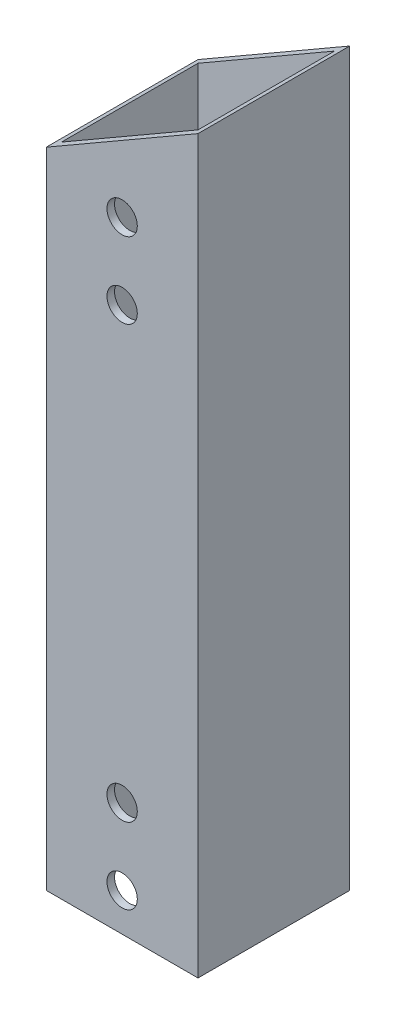
from build123d import *

# Parameters (mm, degrees)
SKETCH_1_R          = 2
EXTRUDE_1_DEPTH     = 20
SKETCH_2_W          = 18
SKETCH_2_H          = 18
CUT_EXTRUDE_1_DEPTH = 102.724540869


with BuildPart() as part:
    # 草图1 → 凸台-拉伸1 (new body)
    with BuildSketch(Plane.XY):
        Polygon((5.657098919, 25.747533472), (25.657098919, 37.294538856), (25.657098919, -59.088008787), (5.657098919, -59.088008787), align=None)
        with Locations((15.657098919, 22.747533472)):
            Circle(SKETCH_1_R, mode=Mode.SUBTRACT)
        with Locations((15.657098919, 12.747533472)):
            Circle(SKETCH_1_R, mode=Mode.SUBTRACT)
        with Locations((15.657098919, -44.088008787)):
            Circle(SKETCH_1_R, mode=Mode.SUBTRACT)
        with Locations((15.657098919, -54.088008787)):
            Circle(SKETCH_1_R, mode=Mode.SUBTRACT)
    extrude(amount=EXTRUDE_1_DEPTH)

    # 草图2 → 切除-拉伸1 (cut, through all)
    with BuildSketch(Plane.XZ.offset(59.088008787)):
        with Locations((15.657098919, 10)):
            Rectangle(SKETCH_2_W, SKETCH_2_H)
    extrude(amount=-CUT_EXTRUDE_1_DEPTH, mode=Mode.SUBTRACT)


solid = part.part
